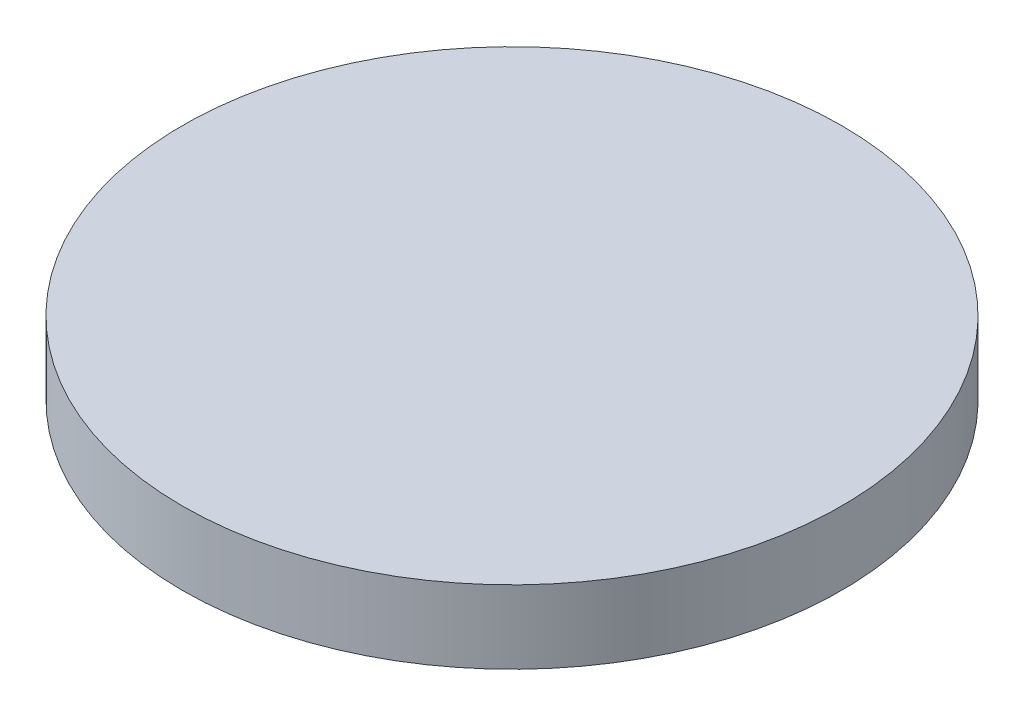
from build123d import *

# Parameters (mm, degrees)
SKETCH1_W = 10
SKETCH1_H = 2.218934107


with BuildPart() as part:
    # Sketch1 → Revolve-Thin1 (revolve)
    with BuildSketch(Plane(origin=(0, 0, 0), x_dir=(0, 0, -1), z_dir=(1, 0, 0)), mode=Mode.PRIVATE) as revolve_thin1_sk:
        with Locations((-10.5, 1.109467053)):
            Rectangle(SKETCH1_W, SKETCH1_H)
    revolve(revolve_thin1_sk.sketch.rotate(Axis((0, 0, 5.5), (0, 1, 0)), 180), axis=Axis((0, 0, 5.5), (0, 1, 0)))


solid = part.part
